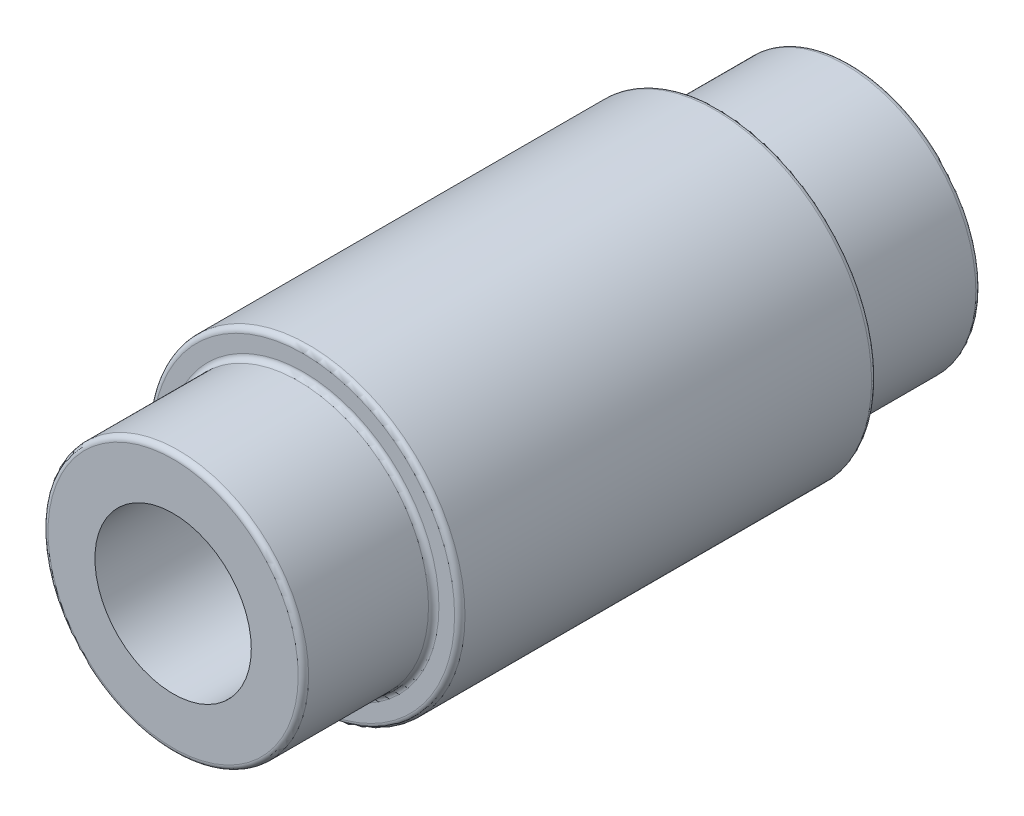
from build123d import *

# Parameters (mm, degrees)
SKETCH1_R           = 0.3
BOSS_EXTRUDE1_DEPTH = 0.4
SKETCH4_R           = 0.25
BOSS_EXTRUDE3_DEPTH = 0.65
SKETCH5_R           = 0.15
CUT_EXTRUDE1_DEPTH  = 2.367479433
FILLET1_R           = 0.01
FILLET2_R           = 0.01


with BuildPart() as part:
    # Sketch1 → Boss-Extrude1 (new, symmetric)
    with BuildSketch(Plane.XY):
        Circle(SKETCH1_R)
    extrude(amount=BOSS_EXTRUDE1_DEPTH, both=True)

    # Sketch4 → Boss-Extrude3 (add, symmetric)
    with BuildSketch(Plane.XY):
        Circle(SKETCH4_R)
    extrude(amount=BOSS_EXTRUDE3_DEPTH, both=True)

    # Sketch5 → Cut-Extrude1 (cut, through all)
    with BuildSketch(Plane.XY.offset(0.65)):
        Circle(SKETCH5_R)
    extrude(amount=-CUT_EXTRUDE1_DEPTH, mode=Mode.SUBTRACT)

    # Fillet1
    fillet1_edges = [part.edges().sort_by_distance(p)[0] for p in [
        (-0.3, 0, -0.4),
        (-0.3, 0, 0.4),
        (-0.25, 0, -0.65),
        (-0.25, 0, 0.65),
    ]]
    fillet(fillet1_edges, radius=FILLET1_R)

    # Fillet2
    fillet2_edges = [part.edges().sort_by_distance(p)[0] for p in [
        (-0.25, 0, -0.4),
        (-0.25, 0, 0.4),
    ]]
    fillet(fillet2_edges, radius=FILLET2_R)


solid = part.part
